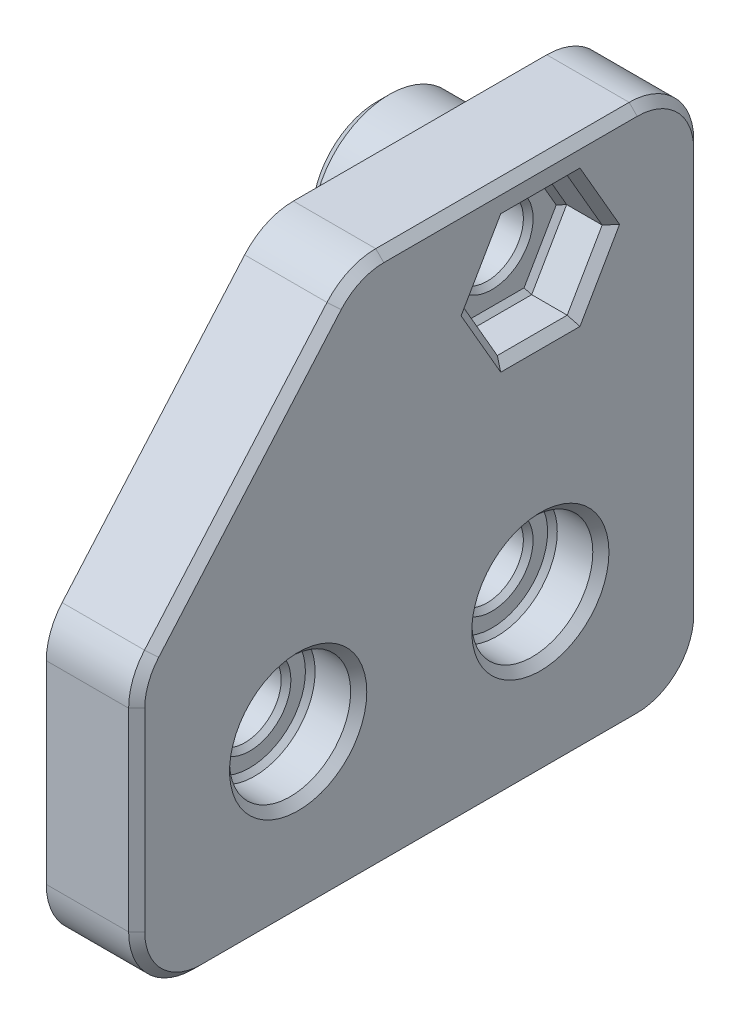
from build123d import *

# Parameters (mm, degrees)
SKETCH1_R           = 2.25
BOSS_EXTRUDE1_DEPTH = 2.6
SKETCH2_R           = 4.75
SKETCH2_R_2         = 2.5
BOSS_EXTRUDE2_DEPTH = 4.5
CHAMFER1_SIZE       = 0.75
SKETCH3_R           = 3.75
BOSS_EXTRUDE3_DEPTH = 3
CHAMFER2_SIZE       = 0.3
CHAMFER3_SIZE       = 0.5


with BuildPart() as part:
    # Sketch1 → Boss-Extrude1 (new body)
    with BuildSketch(Plane(origin=(0, 0, 0), x_dir=(0, 0, -1), z_dir=(1, 0, 0))):
        with BuildLine():
            Line((-21, -10), (6, -10))
            ThreePointArc((6, -10), (8.828427125, -8.828427125), (10, -6))
            Line((10, -6), (10, 19))
            ThreePointArc((10, 19), (8.828427125, 21.828427125), (6, 23))
            Line((6, 23), (-9.695652174, 23))
            ThreePointArc((-9.695652174, 23), (-11.354136506, 22.63997661), (-12.714074263, 21.62471486))
            Line((-12.714074263, 21.62471486), (-24.018422089, 8.62471486))
            ThreePointArc((-24.018422089, 8.62471486), (-24.746577662, 7.401126626), (-25, 6))
            Line((-25, 6), (-25, -6))
            ThreePointArc((-25, -6), (-23.828427125, -8.828427125), (-21, -10))
        make_face()
        with Locations((-15, 0)):
            Circle(SKETCH1_R, mode=Mode.SUBTRACT)
        with Locations((0, 17.25)):
            Circle(SKETCH1_R, mode=Mode.SUBTRACT)
        Circle(SKETCH1_R, mode=Mode.SUBTRACT)
    extrude(amount=BOSS_EXTRUDE1_DEPTH)

    # Sketch2 → Boss-Extrude2 (add)
    with BuildSketch(Plane.ZY):
        with Locations(Location((0, 17.25, 0), (0, 0, 180))):
            Circle(SKETCH2_R)
        with Locations((0, 17.25)):
            Circle(SKETCH2_R_2, mode=Mode.SUBTRACT)
    extrude(amount=BOSS_EXTRUDE2_DEPTH)

    # Chamfer1
    chamfer1_edges = [part.edges().sort_by_distance(p)[0] for p in [
        (-4.5, 17.25, 4.75),
    ]]
    chamfer(chamfer1_edges, length=CHAMFER1_SIZE)

    # Sketch3 → Boss-Extrude3 (add)
    with BuildSketch(Plane(origin=(2.6, 0, 0), x_dir=(0, 0, -1), z_dir=(1, 0, 0))):
        with BuildLine():
            Line((-21, -10), (6, -10))
            ThreePointArc((6, -10), (8.828427125, -8.828427125), (10, -6))
            Line((10, -6), (10, 19))
            ThreePointArc((10, 19), (8.828427125, 21.828427125), (6, 23))
            Line((6, 23), (-9.695652174, 23))
            ThreePointArc((-9.695652174, 23), (-11.354136506, 22.63997661), (-12.714074263, 21.62471486))
            Line((-12.714074263, 21.62471486), (-24.018422089, 8.62471486))
            ThreePointArc((-24.018422089, 8.62471486), (-24.746577662, 7.401126626), (-25, 6))
            Line((-25, 6), (-25, -6))
            ThreePointArc((-25, -6), (-23.828427125, -8.828427125), (-21, -10))
        make_face()
        with Locations((-15, 0)):
            Circle(SKETCH3_R, mode=Mode.SUBTRACT)
        Circle(SKETCH3_R, mode=Mode.SUBTRACT)
        Polygon((2.165063509, 21), (-2.165063509, 21), (-4.330127019, 17.25), (-2.165063509, 13.5), (2.165063509, 13.5), (4.330127019, 17.25), align=None, mode=Mode.SUBTRACT)
    extrude(amount=BOSS_EXTRUDE3_DEPTH)

    # Chamfer2
    chamfer2_edges = [part.edges().sort_by_distance(p)[0] for p in [
        (2.6, 0, 17.25),
        (2.6, 17.25, 2.25),
        (2.6, 0, 2.25),
        (2.6, 0, 3.75),
        (2.6, 0, 18.75),
        (2.6, 19.125, -3.247595264),
        (2.6, 21, 0),
        (2.6, 19.125, 3.247595264),
        (2.6, 15.375, 3.247595264),
        (2.6, 13.5, 0),
        (2.6, 15.375, -3.247595264),
    ]]
    chamfer(chamfer2_edges, length=CHAMFER2_SIZE)

    # Chamfer3
    chamfer3_edges = [part.edges().sort_by_distance(p)[0] for p in [
        (5.6, -8.828427125, 23.828427125),
        (5.6, -10, 7.5),
        (5.6, -8.828427125, -8.828427125),
        (5.6, 6.5, -10),
        (5.6, 21.828427125, -8.828427125),
        (5.6, 23, 1.847826087),
        (5.6, 22.63997661, 11.354136506),
        (5.6, 15.12471486, 18.366248176),
        (5.6, 7.401126626, 24.746577662),
        (5.6, 0, 25),
        (5.6, 0, 18.75),
        (5.6, 0, 3.75),
        (5.6, 19.125, -3.247595264),
        (5.6, 21, 0),
        (5.6, 19.125, 3.247595264),
        (5.6, 15.375, 3.247595264),
        (5.6, 13.5, 0),
        (5.6, 15.375, -3.247595264),
    ]]
    chamfer(chamfer3_edges, length=CHAMFER3_SIZE)


solid = part.part
